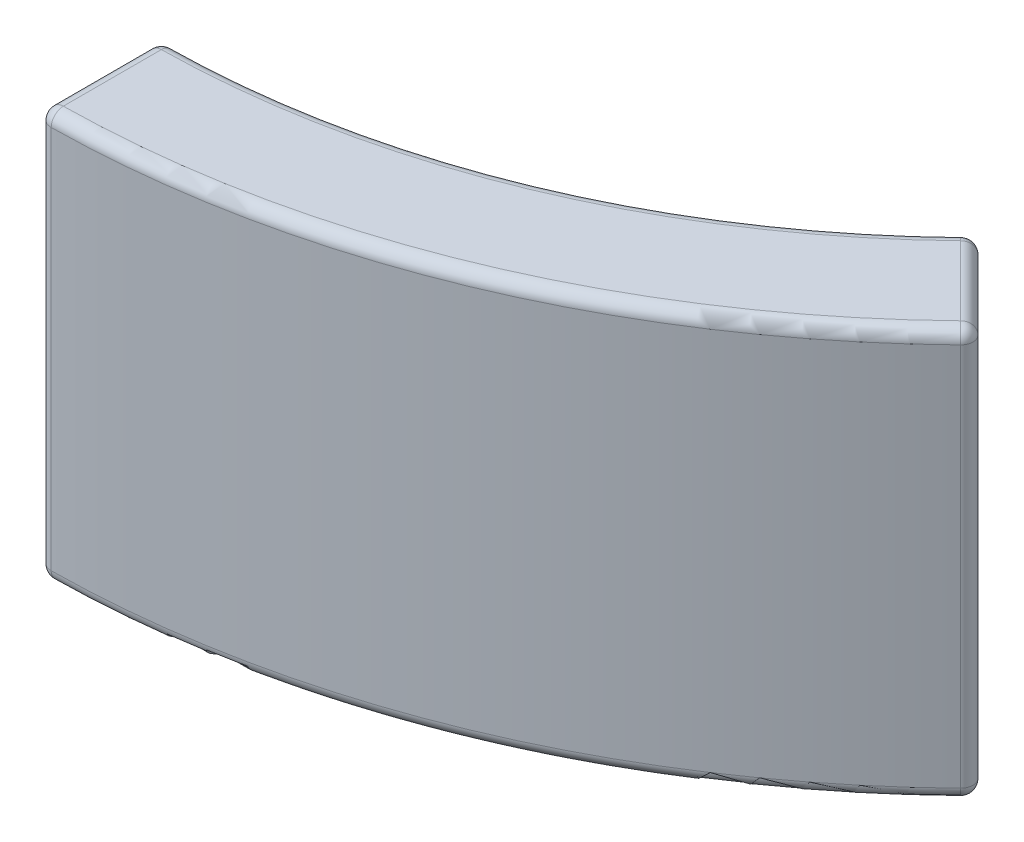
from build123d import *

# Parameters (mm, degrees)
BOSS_EXTRUDE1_DEPTH = 10
FILLET1_R           = 0.3


with BuildPart() as part:
    # Sketch1 → Boss-Extrude1 (new body)
    with BuildSketch(Plane(origin=(0, 0, 0), x_dir=(1, 0, 0), z_dir=(0, 1, 0))):
        with BuildLine():
            Line((14.142135624, -14.142135624), (16.263455967, -16.263455967))
            ThreePointArc((16.263455967, -16.263455967), (8.801718944, -21.249229248), (0, -23))
            Line((0, -23), (0, -20))
            ThreePointArc((0, -20), (7.653668647, -18.47759065), (14.142135624, -14.142135624))
        make_face()
    extrude(amount=BOSS_EXTRUDE1_DEPTH)

    # Fillet1
    fillet1_edges = [part.edges().sort_by_distance(p)[0] for p in [
        (8.801718944, 10, 21.249229248),
        (15.202795796, 10, 15.202795796),
        (7.653668647, 10, 18.47759065),
        (15.202795796, 0, 15.202795796),
        (8.801718944, 0, 21.249229248),
        (0, 0, 21.5),
        (7.653668647, 0, 18.47759065),
        (0, 10, 21.5),
        (14.142135624, 5, 14.142135624),
        (16.263455967, 5, 16.263455967),
        (0, 5, 23),
        (0, 5, 20),
    ]]
    fillet(fillet1_edges, radius=FILLET1_R)


solid = part.part
